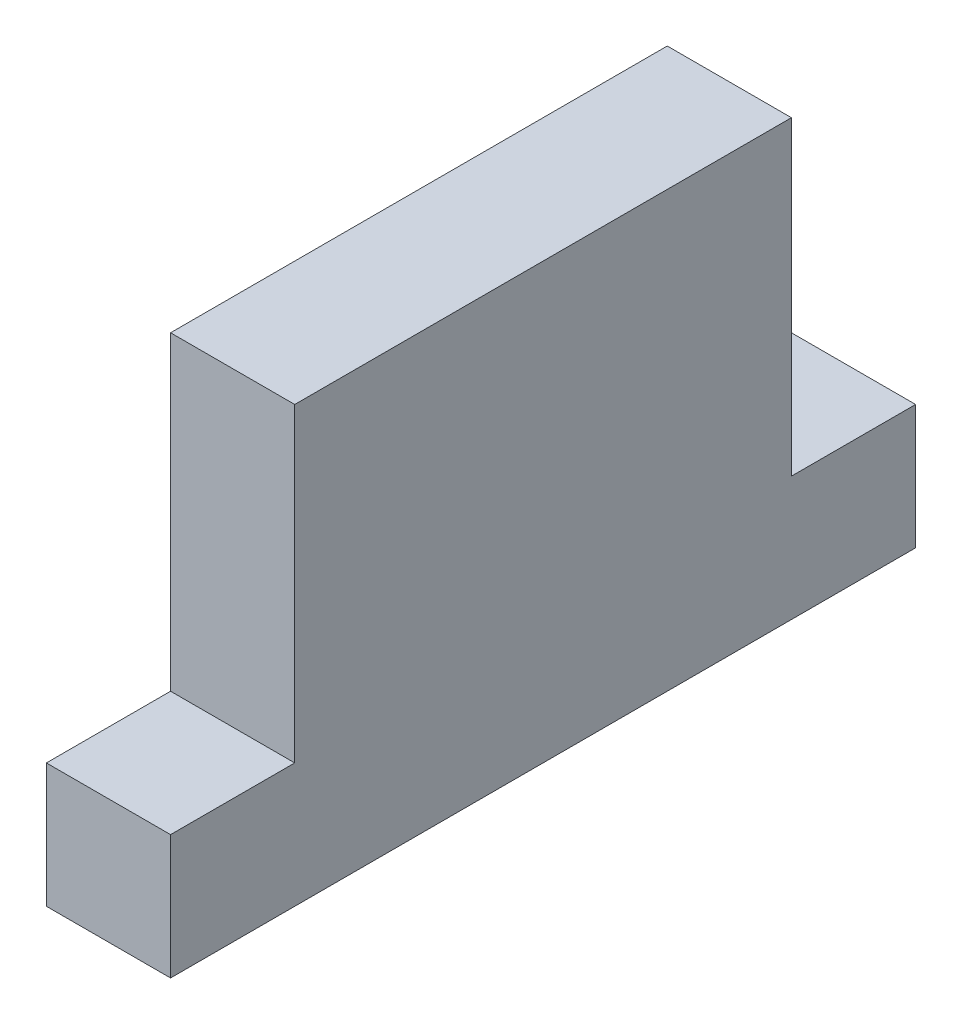
from build123d import *

# Parameters (mm, degrees)
SKETCH_1_W      = 20
SKETCH_1_H      = 120
EXTRUDE_1_DEPTH = 20
EXTRUDE_2_DEPTH = 20


with BuildPart() as part:
    # 草图1 → 凸台-拉伸1 (new body)
    with BuildSketch(Plane(origin=(0, 0, 0), x_dir=(1, 0, 0), z_dir=(0, 1, 0))):
        Rectangle(SKETCH_1_W, SKETCH_1_H)
    extrude(amount=EXTRUDE_1_DEPTH)

    # 草图2 → 凸台-拉伸2 (add)
    with BuildSketch(Plane(origin=(10, 0, 0), x_dir=(0, 0, -1), z_dir=(1, 0, 0))):
        Polygon((0, 20), (40, 20), (40, 70), (-40, 70), (-40, 20), align=None)
    extrude(amount=-EXTRUDE_2_DEPTH)


solid = part.part
